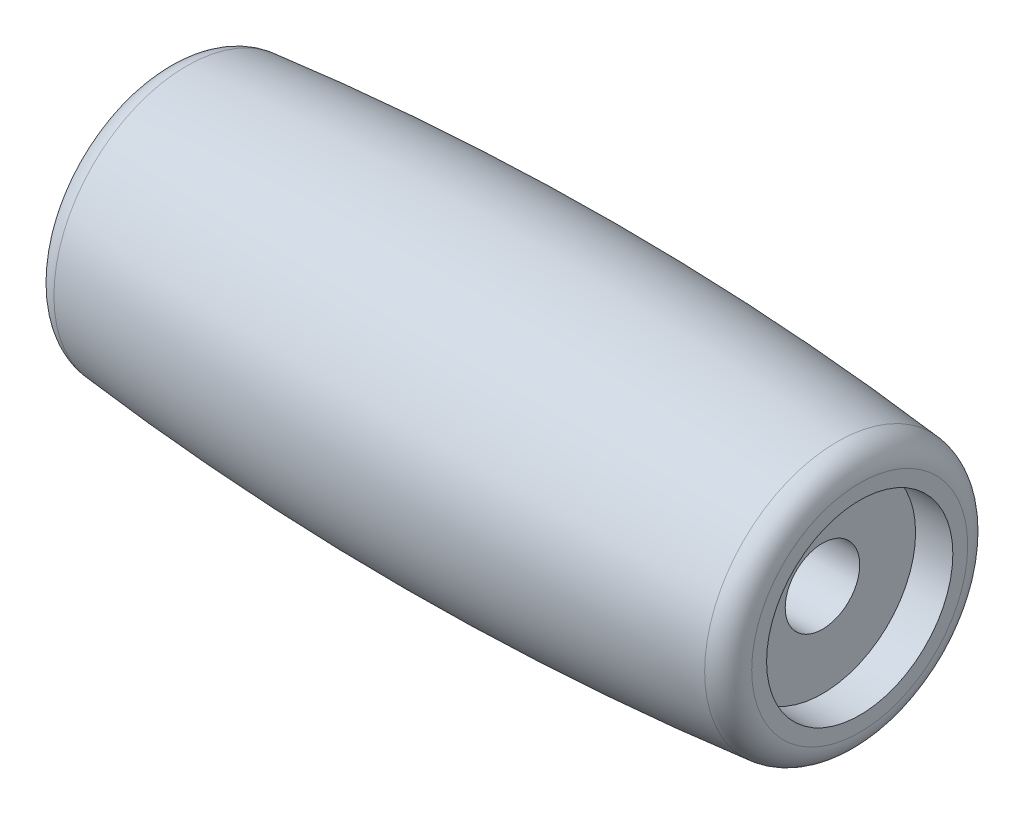
from build123d import *


with BuildPart() as part:
    # Sketch1 → Revolve1 (revolve)
    with BuildSketch(Plane.XY, mode=Mode.PRIVATE) as revolve1_sk:
        with BuildLine():
            Line((-1.747933884, 1.5), (1.747933884, 1.5))
            Line((1.747933884, 1.5), (12.5, 1.5))
            Line((12.5, 1.5), (12.5, 3.75))
            Line((12.5, 3.75), (14, 3.75))
            Line((14, 3.75), (14, 4.348576665))
            ThreePointArc((14, 4.348576665), (13.741609048, 5.019408999), (13.099967959, 5.343567322))
            ThreePointArc((13.099967959, 5.343567322), (0, 6), (-13.099967959, 5.343567322))
            ThreePointArc((-13.099967959, 5.343567322), (-13.741609048, 5.019408999), (-14, 4.348576665))
            Line((-14, 4.348576665), (-14, 3.75))
            Line((-14, 3.75), (-12.5, 3.75))
            Line((-12.5, 3.75), (-12.5, 1.5))
            Line((-12.5, 1.5), (-1.747933884, 1.5))
        make_face()
    revolve(revolve1_sk.sketch.rotate(Axis((0, 0, 0), (1, 0, 0)), 90), axis=Axis((0, 0, 0), (1, 0, 0)))


solid = part.part
